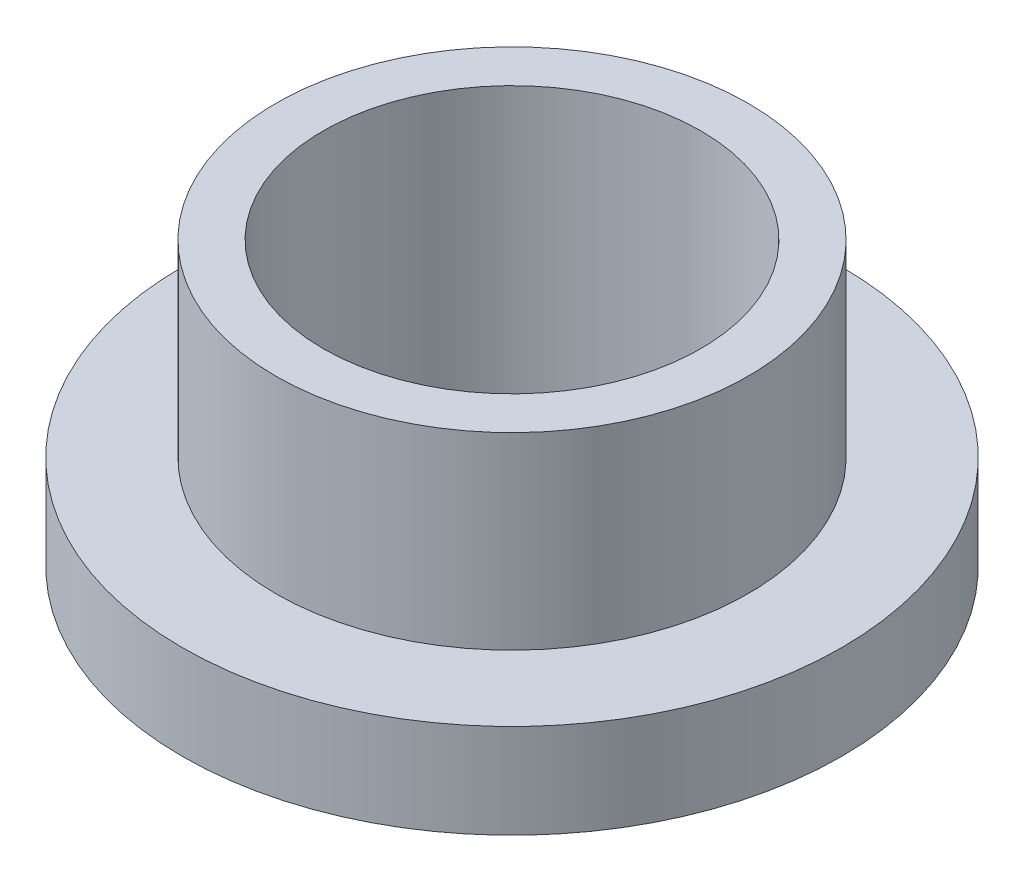
from build123d import *

# Parameters (mm, degrees)
SKETCH2_R           = 7.9629
SKETCH2_R_2         = 6.3627
BOSS_EXTRUDE1_DEPTH = 9.525
SKETCH3_R           = 11.1125
SKETCH3_R_2         = 7.9629
BOSS_EXTRUDE2_DEPTH = 3.175


with BuildPart() as part:
    # Sketch2 → Boss-Extrude1 (new body)
    with BuildSketch(Plane(origin=(0, 0, 0), x_dir=(1, 0, 0), z_dir=(0, 1, 0))):
        with Locations(Location((0, 0, 0), (0, 0, 90))):
            Circle(SKETCH2_R)
        with Locations(Location((0, 0, 0), (0, 0, 90))):
            Circle(SKETCH2_R_2, mode=Mode.SUBTRACT)
    extrude(amount=BOSS_EXTRUDE1_DEPTH)

    # Sketch3 → Boss-Extrude2 (add)
    with BuildSketch(Plane(origin=(0, 0, 0), x_dir=(1, 0, 0), z_dir=(0, 1, 0))):
        with Locations(Location((0, 0, 0), (0, 0, 270))):
            Circle(SKETCH3_R)
        with Locations(Location((0, 0, 0), (0, 0, 90))):
            Circle(SKETCH3_R_2, mode=Mode.SUBTRACT)
    extrude(amount=BOSS_EXTRUDE2_DEPTH)


solid = part.part
